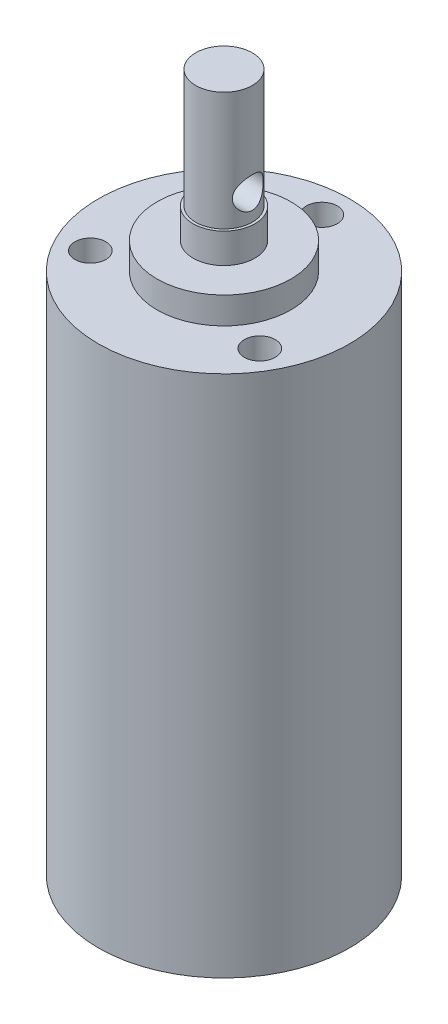
from build123d import *

# Parameters (mm, degrees)
SKETCH_1_R               = 12.2
EXTRUDE_1_DEPTH          = 50.8
SKETCH_2_R               = 2.75
EXTRUDE_2_DEPTH          = 4
SKETCH_4_R               = 6.5
EXTRUDE_3_DEPTH          = 2.6
SKETCH_5_R               = 3
EXTRUDE_4_DEPTH          = 2.9
EXTRUDE_START            = 11.5
SKETCH_6_R               = 2.75
EXTRUDE_5_DEPTH          = 11.5
CUT_EXTRUDE_1_DEPTH      = 11.5
CUT_EXTRUDE_1_DEPTH_BACK = 11.5
SKETCH_7_R               = 1.5
SKETCH_8_R               = 1.5
CUT_EXTRUDE_2_DEPTH      = 11.5


with BuildPart() as part:
    # 草图1 → 凸台-拉伸1 (new body)
    with BuildSketch(Plane(origin=(0, 0, 0), x_dir=(1, 0, 0), z_dir=(0, 1, 0))):
        Circle(SKETCH_1_R)
    extrude(amount=EXTRUDE_1_DEPTH)

    # 草图2 → 凸台-拉伸2 (add)
    with BuildSketch(Plane.XZ):
        Circle(SKETCH_2_R)
    extrude(amount=EXTRUDE_2_DEPTH)

    # 草图4 → 凸台-拉伸3 (add)
    with BuildSketch(Plane(origin=(0, 50.8, 0), x_dir=(1, 0, 0), z_dir=(0, 1, 0))):
        Circle(SKETCH_4_R)
    extrude(amount=EXTRUDE_3_DEPTH)

    # 草图5 → 凸台-拉伸4 (add)
    with BuildSketch(Plane(origin=(0, 53.4, 0), x_dir=(1, 0, 0), z_dir=(0, 1, 0))):
        Circle(SKETCH_5_R)
    extrude(amount=EXTRUDE_4_DEPTH)

    # 草图6 → 凸台-拉伸5 (add)
    with BuildSketch(Plane(origin=(0, 56.3, 0), x_dir=(1, 0, 0), z_dir=(0, 1, 0)).offset(EXTRUDE_START)):
        Circle(SKETCH_6_R)
    extrude(amount=-EXTRUDE_5_DEPTH)

    # 草图7 → 切除-拉伸1 (cut, two sides: drawn at the far end of the back side and taken through both)
    with BuildSketch(Plane(origin=(0, 0, 0), x_dir=(0, 0, -1), z_dir=(1, 0, 0)).offset(-CUT_EXTRUDE_1_DEPTH_BACK)):
        with Locations((0, 58.8)):
            Circle(SKETCH_7_R)
    extrude(amount=CUT_EXTRUDE_1_DEPTH + CUT_EXTRUDE_1_DEPTH_BACK, mode=Mode.SUBTRACT)

    # 草图8 → 切除-拉伸2 (cut)
    with BuildSketch(Plane(origin=(0, 50.8, 0), x_dir=(1, 0, 0), z_dir=(0, 1, 0))):
        with Locations((0, 9.5)):
            Circle(SKETCH_8_R)
        with Locations((8.227241336, -4.75)):
            Circle(SKETCH_8_R)
        with Locations((-8.227241336, -4.75)):
            Circle(SKETCH_8_R)
    extrude(amount=-CUT_EXTRUDE_2_DEPTH, mode=Mode.SUBTRACT)


solid = part.part
